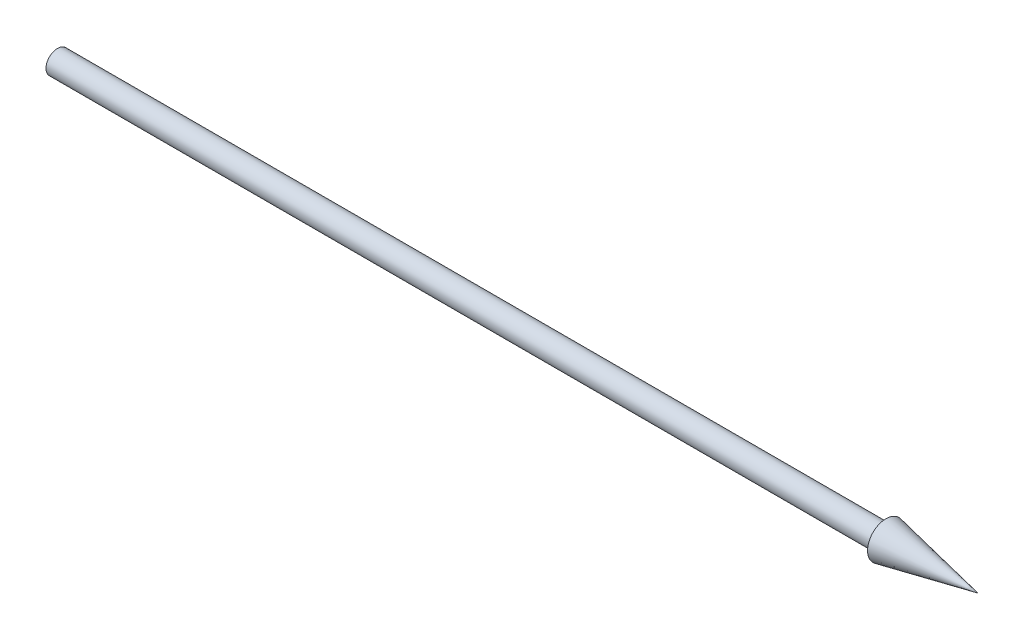
from build123d import *


with BuildPart() as part:
    # Sketch1 → Revolve1 (revolve)
    with BuildSketch(Plane.XY, mode=Mode.PRIVATE) as revolve1_sk:
        Polygon((0, 0), (200, 0), (180, 4), (180, 2.5), (0, 2.5), align=None)
    revolve(revolve1_sk.sketch.rotate(Axis((0, 0, 0), (1, 0, 0)), 90), axis=Axis((0, 0, 0), (1, 0, 0)))


solid = part.part
